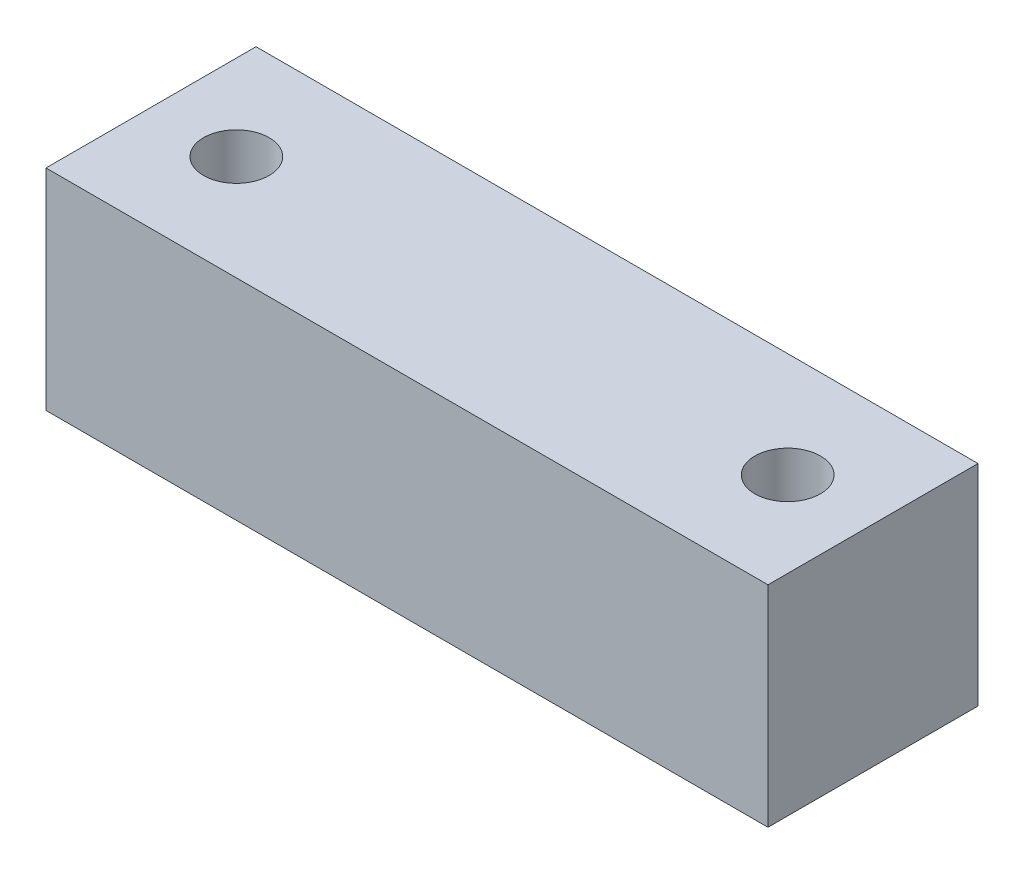
from build123d import *

# Parameters (mm, degrees)
SKETCH1_W           = 55
SKETCH1_H           = 8
BOSS_EXTRUDE1_DEPTH = 16
SKETCH2_R           = 2.5
CUT_EXTRUDE1_DEPTH  = 16
SKETCH3_W           = 55
SKETCH3_H           = 16
BOSS_EXTRUDE2_DEPTH = 4
SKETCH4_W           = 55
SKETCH4_H           = 16
BOSS_EXTRUDE3_DEPTH = 4


with BuildPart() as part:
    # Sketch1 → Boss-Extrude1 (new body)
    with BuildSketch(Plane(origin=(0, 0, 0), x_dir=(1, 0, 0), z_dir=(0, 1, 0))):
        with Locations((27.5, 4)):
            Rectangle(SKETCH1_W, SKETCH1_H)
    extrude(amount=BOSS_EXTRUDE1_DEPTH)

    # Sketch2 → Cut-Extrude1 (cut)
    with BuildSketch(Plane(origin=(0, 16, 0), x_dir=(1, 0, 0), z_dir=(0, 1, 0))):
        with Locations(Location((6.5, 4, 0), (0, 0, 270))):
            Circle(SKETCH2_R)
        with Locations(Location((48.5, 4, 0), (0, 0, 270))):
            Circle(SKETCH2_R)
    extrude(amount=-CUT_EXTRUDE1_DEPTH, mode=Mode.SUBTRACT)

    # Sketch3 → Boss-Extrude2 (add)
    with BuildSketch(Plane.XY):
        with Locations((27.5, 8)):
            Rectangle(SKETCH3_W, SKETCH3_H)
    extrude(amount=BOSS_EXTRUDE2_DEPTH)

    # Sketch4 → Boss-Extrude3 (add)
    with BuildSketch(Plane(origin=(0, 0, -8), x_dir=(-1, 0, 0), z_dir=(0, 0, -1))):
        with Locations((-27.5, 8)):
            Rectangle(SKETCH4_W, SKETCH4_H)
    extrude(amount=BOSS_EXTRUDE3_DEPTH)


solid = part.part
